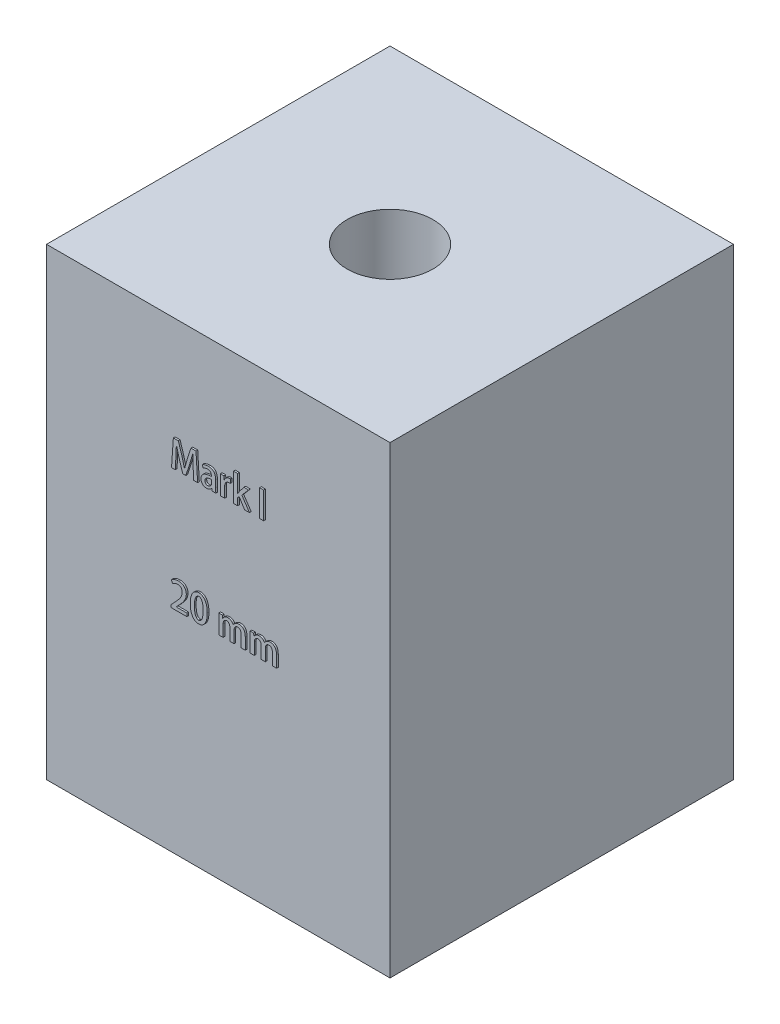
from build123d import *

# Parameters (mm, degrees)
CROQUIS1_W              = 20
CROQUIS1_H              = 20
CROQUIS1_R              = 2.5
SALIENTE_EXTRUIR1_DEPTH = 27
CROQUIS2_2_W            = 0.238171994
CROQUIS2_2_H            = 1.552222223
SALIENTE_EXTRUIR2_DEPTH = 0.1


with BuildPart() as part:
    # Croquis1 → Saliente-Extruir1 (new body)
    with BuildSketch(Plane(origin=(0, 0, 0), x_dir=(1, 0, 0), z_dir=(0, 1, 0))):
        Rectangle(CROQUIS1_W, CROQUIS1_H)
        Circle(CROQUIS1_R, mode=Mode.SUBTRACT)
    extrude(amount=SALIENTE_EXTRUIR1_DEPTH)

    # Croquis2<2> → Saliente-Extruir2 (add)
    # profile 1 of 9: a face of its own
    with BuildSketch(Plane.XY.offset(10)):
        with BuildLine():
            Line((-1.196299168, 21.029080524), (-1.489029741, 21.029080524))
            Line((-1.489029741, 21.029080524), (-1.713120041, 20.346907093))
            add(Edge.make_bspline(
                [(-1.713120041, 20.346907093), (-1.727697615, 20.299716085), (-1.756231951, 20.207343783), (-1.795341625, 20.070753521), (-1.829992127, 19.939079232), (-1.850660973, 19.852657221), (-1.860771731, 19.810381416)],
                knots=[0, 0, 0, 0, 1.06482216, 2.08429696, 3.06287894, 4, 4, 4, 4], degree=3))
            Line((-1.860771731, 19.810381416), (-1.866551238, 19.810381416))
            add(Edge.make_bspline(
                [(-1.866551238, 19.810381416), (-1.876481422, 19.853051166), (-1.896683618, 19.939859498), (-1.93070374, 20.071488595), (-1.967459767, 20.207101232), (-1.994351955, 20.298408277), (-2.008015817, 20.344801184)],
                knots=[0, 0, 0, 0, 0.950771496, 1.934271678, 2.950408035, 4, 4, 4, 4], degree=3))
            Line((-2.008015817, 20.344801184), (-2.225903251, 21.029080524))
            Line((-2.225903251, 21.029080524), (-2.516614993, 21.029080524))
            Line((-2.516614993, 21.029080524), (-2.621630897, 19.479409339))
            Line((-2.621630897, 19.479409339), (-2.403560427, 19.479409339))
            Line((-2.403560427, 19.479409339), (-2.36924029, 20.115225551))
            add(Edge.make_bspline(
                [(-2.36924029, 20.115225551), (-2.366142688, 20.170919846), (-2.35989255, 20.283296133), (-2.353809897, 20.423803434), (-2.348367501, 20.535729765), (-2.345730048, 20.61699773), (-2.342790327, 20.695298568), (-2.341738393, 20.746445045), (-2.341221555, 20.771574379)],
                knots=[0, 0, 0, 0, 1.528265809, 3.083634274, 3.853229214, 4.59840858, 5.311368824, 6, 6, 6, 6], degree=3))
            Line((-2.341221555, 20.771574379), (-2.334920154, 20.771597581))
            add(Edge.make_bspline(
                [(-2.334920154, 20.771597581), (-2.324589296, 20.723617077), (-2.303631025, 20.626278754), (-2.266531143, 20.479508668), (-2.225758304, 20.329473172), (-2.195122831, 20.22906041), (-2.179605039, 20.178198314)],
                knots=[0, 0, 0, 0, 0.959753872, 1.947058171, 2.960122984, 4, 4, 4, 4], degree=3))
            Line((-2.179605039, 20.178198314), (-1.967492815, 19.493601312))
            Line((-1.967492815, 19.493601312), (-1.791854471, 19.493601312))
            Line((-1.791854471, 19.493601312), (-1.561707676, 20.192452732))
            add(Edge.make_bspline(
                [(-1.561707676, 20.192452732), (-1.545557325, 20.241909213), (-1.513574545, 20.339848618), (-1.469197981, 20.486028271), (-1.427941936, 20.629553544), (-1.402746733, 20.724599981), (-1.390294614, 20.771574379)],
                knots=[0, 0, 0, 0, 1.033513873, 2.046682856, 3.034620343, 4, 4, 4, 4], degree=3))
            Line((-1.390294614, 20.771574379), (-1.384050501, 20.771597581))
            add(Edge.make_bspline(
                [(-1.384050501, 20.771597581), (-1.384147418, 20.746657815), (-1.384345026, 20.695806648), (-1.383338746, 20.618262138), (-1.381707988, 20.538078238), (-1.377545118, 20.428380993), (-1.371719332, 20.291107159), (-1.366485475, 20.18142271), (-1.363896272, 20.12716152)],
                knots=[0, 0, 0, 0, 0.69615936, 1.419440619, 2.164688967, 2.934803833, 4.483639269, 6, 6, 6, 6], degree=3))
            Line((-1.363896272, 20.12716152), (-1.32954205, 19.479409339))
            Line((-1.32954205, 19.479409339), (-1.103432918, 19.479409339))
            Line((-1.103432918, 19.479409339), (-1.196299168, 21.029080524))
        make_face()
    # profile 2 of 9: a face of its own
    with BuildSketch(Plane.XY.offset(10)):
        with BuildLine():
            add(Edge.make_bspline(
                [(-0.053952166, 20.155506797), (-0.053933683, 20.171094279), (-0.053897286, 20.201789221), (-0.057518774, 20.247008773), (-0.063893546, 20.290439821), (-0.073214651, 20.332080632), (-0.085936266, 20.371763587), (-0.101413142, 20.409687835), (-0.120056057, 20.445711117), (-0.141545368, 20.479861857), (-0.167086723, 20.511273005), (-0.197339407, 20.538867014), (-0.232386885, 20.562185402), (-0.272154981, 20.581216365), (-0.316470833, 20.596407), (-0.365308531, 20.607712644), (-0.418720262, 20.615108287), (-0.45586616, 20.61654487), (-0.475152092, 20.617290736)],
                knots=[0, 0, 0, 0, 1.04529413, 2.058397975, 3.039753549, 3.988049356, 4.917306062, 5.832005784, 6.732558164, 7.634995369, 8.534400609, 9.439717093, 10.371077683, 11.347885902, 12.389132223, 13.507522911, 14.705920534, 16, 16, 16, 16], degree=3))
            add(Edge.make_bspline(
                [(-0.475152092, 20.617290736), (-0.492957595, 20.616816764), (-0.528048962, 20.615882654), (-0.579600467, 20.61088989), (-0.629120436, 20.602765232), (-0.676037595, 20.591206125), (-0.720086934, 20.577835591), (-0.760725874, 20.56297161), (-0.797576215, 20.546416367), (-0.820085609, 20.533481991), (-0.830943079, 20.527243058)],
                knots=[0, 0, 0, 0, 1.151566781, 2.269526023, 3.346377101, 4.393757963, 5.391790339, 6.321988655, 7.190606464, 8, 8, 8, 8], degree=3))
            Line((-0.830943079, 20.527243058), (-0.781123083, 20.369063254))
            add(Edge.make_bspline(
                [(-0.781123083, 20.369063254), (-0.77171247, 20.37510656), (-0.75272953, 20.387297021), (-0.722239537, 20.403059962), (-0.690103274, 20.417263833), (-0.656139477, 20.428702506), (-0.621351216, 20.438541683), (-0.585956767, 20.445552861), (-0.550147937, 20.449783122), (-0.526200151, 20.450385225), (-0.514162975, 20.450687867)],
                knots=[0, 0, 0, 0, 0.947728913, 1.911743672, 2.906591377, 3.923705885, 4.947352295, 5.969890554, 6.979580645, 8, 8, 8, 8], degree=3))
            add(Edge.make_bspline(
                [(-0.514162975, 20.450687867), (-0.501813894, 20.449873349), (-0.478242904, 20.448318659), (-0.444972946, 20.442010936), (-0.415449317, 20.43362517), (-0.389446639, 20.42296027), (-0.367418177, 20.408938358), (-0.348994114, 20.39252782), (-0.334418974, 20.373321038), (-0.321472296, 20.344609444), (-0.310378364, 20.308152502), (-0.300596189, 20.265632707), (-0.296081909, 20.224913524), (-0.297364519, 20.198636491), (-0.297989886, 20.185824502)],
                knots=[0, 0, 0, 0, 1.124941475, 2.147203117, 3.073276344, 3.914150165, 4.693859246, 5.436944029, 6.148486199, 6.868538222, 8.288979618, 9.609682438, 10.834544209, 12, 12, 12, 12], degree=3))
            add(Edge.make_bspline(
                [(-0.297989886, 20.185824502), (-0.320678653, 20.185539999), (-0.365025123, 20.184983922), (-0.429782822, 20.180745531), (-0.490876774, 20.172779945), (-0.548357177, 20.161890924), (-0.60242818, 20.148446821), (-0.652727709, 20.130932907), (-0.699627981, 20.11078697), (-0.742785665, 20.087455124), (-0.78181461, 20.060849193), (-0.815831886, 20.03054531), (-0.844514985, 19.996643678), (-0.868702711, 19.959781778), (-0.887106432, 19.919009882), (-0.900985991, 19.875142448), (-0.90956491, 19.827714103), (-0.911105263, 19.794968866), (-0.911897994, 19.778116776)],
                knots=[0, 0, 0, 0, 1.312583045, 2.565517338, 3.751913568, 4.874585872, 5.948775456, 6.97196923, 7.952367169, 8.899011352, 9.80588498, 10.679130641, 11.525793372, 12.368308044, 13.221239438, 14.104974037, 15.024739096, 16, 16, 16, 16], degree=3))
            add(Edge.make_bspline(
                [(-0.911897994, 19.778116776), (-0.911473645, 19.767156476), (-0.910641021, 19.745651047), (-0.906633242, 19.713979761), (-0.899372869, 19.68374055), (-0.890222197, 19.654513549), (-0.877670348, 19.62680416), (-0.862708273, 19.600423672), (-0.845267409, 19.575176501), (-0.825103672, 19.551624148), (-0.802677089, 19.5297669), (-0.777493306, 19.511004679), (-0.750365313, 19.494799783), (-0.721140808, 19.481133874), (-0.689496917, 19.470690929), (-0.655746236, 19.462757034), (-0.61969828, 19.457773568), (-0.594937614, 19.456639732), (-0.582212035, 19.456057004)],
                knots=[0, 0, 0, 0, 1.019558823, 2.000497171, 2.961865832, 3.90763667, 4.843526869, 5.78386522, 6.724423229, 7.691661655, 8.662438953, 9.629634663, 10.603980382, 11.596308817, 12.622532153, 13.696327026, 14.81604254, 16, 16, 16, 16], degree=3))
            add(Edge.make_bspline(
                [(-0.582212035, 19.456057004), (-0.565841961, 19.456612545), (-0.533867175, 19.457697653), (-0.487707844, 19.466370755), (-0.444274735, 19.478668363), (-0.404395551, 19.496746116), (-0.368185088, 19.518848134), (-0.335215096, 19.543532898), (-0.306123182, 19.571455519), (-0.289918348, 19.592526447), (-0.281857566, 19.603007774)],
                knots=[0, 0, 0, 0, 1.130657597, 2.208452709, 3.237069398, 4.244418774, 5.223812689, 6.164576675, 7.087004055, 8, 8, 8, 8], degree=3))
            Line((-0.281857566, 19.603007774), (-0.275253111, 19.603065349))
            Line((-0.275253111, 19.603065349), (-0.258392086, 19.477618228))
            Line((-0.258392086, 19.477618228), (-0.037732768, 19.477618228))
            add(Edge.make_bspline(
                [(-0.037732768, 19.477618228), (-0.040897849, 19.496597162), (-0.047581659, 19.536675639), (-0.051747532, 19.600214154), (-0.05403103, 19.668395576), (-0.054172931, 19.715246615), (-0.054245195, 19.739105893)],
                knots=[0, 0, 0, 0, 0.879539962, 1.857355241, 2.908840502, 4, 4, 4, 4], degree=3))
            Line((-0.054245195, 19.739105893), (-0.053952166, 20.155506797))
        make_face()
        with BuildLine():
            add(Edge.make_bspline(
                [(-0.292123874, 19.85181673), (-0.292565708, 19.843563522), (-0.293425459, 19.827503836), (-0.297118337, 19.804055524), (-0.302157272, 19.781770952), (-0.30974875, 19.760760078), (-0.318698035, 19.74068664), (-0.329992125, 19.721921664), (-0.342912234, 19.704123049), (-0.357899957, 19.687847624), (-0.374138828, 19.672946445), (-0.391614279, 19.660011148), (-0.409781112, 19.64873434), (-0.42910308, 19.639619265), (-0.449388406, 19.632186668), (-0.470747733, 19.627011652), (-0.493045123, 19.623714024), (-0.508187646, 19.623016293), (-0.515922865, 19.622659873)],
                knots=[0, 0, 0, 0, 1.1127689, 2.165305488, 3.194083487, 4.185588777, 5.169981375, 6.15040018, 7.13046498, 8.12816315, 9.12586132, 10.095335325, 11.053196287, 12.001774197, 12.968470205, 13.958837393, 14.957317833, 16, 16, 16, 16], degree=3))
            add(Edge.make_bspline(
                [(-0.515922865, 19.622659873), (-0.526348867, 19.622986841), (-0.54677129, 19.623627305), (-0.576043385, 19.632361798), (-0.60296697, 19.646059855), (-0.627344866, 19.665200397), (-0.647756744, 19.69069521), (-0.66238159, 19.722675436), (-0.671428419, 19.760622731), (-0.672737046, 19.787936502), (-0.673432972, 19.802461914)],
                knots=[0, 0, 0, 0, 0.925162071, 1.812204857, 2.691873356, 3.602553412, 4.549923018, 5.56994314, 6.707700436, 8, 8, 8, 8], degree=3))
            add(Edge.make_bspline(
                [(-0.673432972, 19.802461914), (-0.672504166, 19.814124606), (-0.670710258, 19.836650073), (-0.664133484, 19.868903199), (-0.653394707, 19.897940713), (-0.639623735, 19.923993766), (-0.622452724, 19.947140376), (-0.60120143, 19.966485377), (-0.576944474, 19.983265842), (-0.53961783, 20.000360001), (-0.489300298, 20.016507544), (-0.426242327, 20.030369907), (-0.360162716, 20.037877182), (-0.315313119, 20.037760195), (-0.292416903, 20.037700472)],
                knots=[0, 0, 0, 0, 0.831751151, 1.606454387, 2.332498033, 3.02628555, 3.696675427, 4.370806108, 5.061344671, 5.786088267, 7.281491765, 8.811961156, 10.372470837, 12, 12, 12, 12], degree=3))
            Line((-0.292416903, 20.037700472), (-0.292123874, 19.85181673))
        make_face(mode=Mode.SUBTRACT)
    # profile 3 of 9: a face of its own
    with BuildSketch(Plane.XY.offset(10)):
        with BuildLine():
            add(Edge.make_bspline(
                [(0.798083824, 20.611553336), (0.788539911, 20.613210649), (0.769047446, 20.61659554), (0.749267113, 20.617055819), (0.739171639, 20.617290736)],
                knots=[0, 0, 0, 0, 0.97924127, 2, 2, 2, 2], degree=3))
            add(Edge.make_bspline(
                [(0.739171639, 20.617290736), (0.723847826, 20.616453707), (0.693455305, 20.614793584), (0.648964014, 20.602845287), (0.606665471, 20.583392189), (0.566554279, 20.557213359), (0.529366688, 20.524773207), (0.497456952, 20.485421616), (0.469512451, 20.440761818), (0.456024619, 20.407616391), (0.449083192, 20.39055831)],
                knots=[0, 0, 0, 0, 0.938175605, 1.860732817, 2.801619752, 3.780189859, 4.786007179, 5.811395864, 6.873648904, 8, 8, 8, 8], degree=3))
            Line((0.449083192, 20.39055831), (0.440870375, 20.390609296))
            Line((0.440870375, 20.390609296), (0.432657557, 20.593479237))
            Line((0.432657557, 20.593479237), (0.225386747, 20.593479237))
            add(Edge.make_bspline(
                [(0.225386747, 20.593479237), (0.226735788, 20.567494093), (0.229489608, 20.514450168), (0.231570538, 20.432608946), (0.233218682, 20.345688049), (0.233208637, 20.28584588), (0.233203418, 20.254753506)],
                knots=[0, 0, 0, 0, 0.921405029, 1.880880017, 2.898962507, 4, 4, 4, 4], degree=3))
            Line((0.233203418, 20.254753506), (0.233496446, 19.478268161))
            Line((0.233496446, 19.478268161), (0.47166844, 19.478268161))
            Line((0.47166844, 19.478268161), (0.47166844, 20.070276186))
            add(Edge.make_bspline(
                [(0.47166844, 20.070276186), (0.472033638, 20.082301823), (0.47274468, 20.105715785), (0.475848675, 20.139945871), (0.481442585, 20.172189381), (0.489050183, 20.202603479), (0.498765514, 20.231145838), (0.510353047, 20.258001793), (0.524589729, 20.282599339), (0.540410607, 20.305428882), (0.558265096, 20.325823855), (0.577615533, 20.344024212), (0.599106245, 20.358987052), (0.621896445, 20.371773551), (0.646567142, 20.381305855), (0.672514788, 20.388861822), (0.700215782, 20.393190292), (0.719212277, 20.393972346), (0.728905617, 20.394371404)],
                knots=[0, 0, 0, 0, 1.241840886, 2.417868999, 3.544527356, 4.616704577, 5.650820151, 6.654086497, 7.630544836, 8.5797601, 9.516878827, 10.423948895, 11.314471818, 12.213419717, 13.114913654, 14.038234368, 14.998969914, 16, 16, 16, 16], degree=3))
            add(Edge.make_bspline(
                [(0.728905617, 20.394371404), (0.741154195, 20.394190832), (0.764272582, 20.393850016), (0.787101102, 20.390214468), (0.797834621, 20.388505106)],
                knots=[0, 0, 0, 0, 1.059639438, 2, 2, 2, 2], degree=3))
            Line((0.797834621, 20.388505106), (0.798083824, 20.611553336))
        make_face()
    # profile 4 of 9: a face of its own
    with BuildSketch(Plane.XY.offset(10)):
        with BuildLine():
            Line((1.473955281, 20.134031505), (1.867275682, 20.594647054))
            Line((1.867275682, 20.594647054), (1.589518491, 20.594647054))
            Line((1.589518491, 20.594647054), (1.311761301, 20.221284671))
            add(Edge.make_bspline(
                [(1.311761301, 20.221284671), (1.297091766, 20.200201073), (1.267485244, 20.157649487), (1.240155846, 20.113600536), (1.226367706, 20.091377101)],
                knots=[0, 0, 0, 0, 0.99096644, 2, 2, 2, 2], degree=3))
            Line((1.226367706, 20.091377101), (1.222554612, 20.091419494))
            Line((1.222554612, 20.091419494), (1.222554612, 21.103899887))
            Line((1.222554612, 21.103899887), (0.984382618, 21.103899887))
            Line((0.984382618, 21.103899887), (0.984382618, 19.476589047))
            Line((0.984382618, 19.476589047), (1.222554612, 19.476589047))
            Line((1.222554612, 19.476589047), (1.222554612, 19.878359438))
            Line((1.222554612, 19.878359438), (1.313788726, 19.989962325))
            Line((1.313788726, 19.989962325), (1.634121836, 19.476589047))
            Line((1.634121836, 19.476589047), (1.9179613, 19.476589047))
            Line((1.9179613, 19.476589047), (1.473955281, 20.134031505))
        make_face()
    # profile 5 of 9: a face of its own
    with BuildSketch(Plane.XY.offset(10)):
        with Locations((2.624013114, 20.252700159)):
            Rectangle(CROQUIS2_2_W, CROQUIS2_2_H)
    # profile 6 of 9: a face of its own
    with BuildSketch(Plane.XY.offset(10)):
        with BuildLine():
            Line((-1.729779412, 12.591282835), (-2.347079547, 12.591282835))
            Line((-2.347079547, 12.591282835), (-2.347079547, 12.595407576))
            Line((-2.347079547, 12.595407576), (-2.221379213, 12.725336915))
            add(Edge.make_bspline(
                [(-2.221379213, 12.725336915), (-2.204836392, 12.741929731), (-2.172130158, 12.774734809), (-2.125007035, 12.824611936), (-2.080052764, 12.874052065), (-2.037820827, 12.923529334), (-1.997692725, 12.972318339), (-1.95987069, 13.0207424), (-1.925257654, 13.069323079), (-1.891976613, 13.1169088), (-1.862320849, 13.164984102), (-1.83624939, 13.213577533), (-1.814289817, 13.262916553), (-1.795899775, 13.312829022), (-1.781923907, 13.363609606), (-1.771217384, 13.414809568), (-1.764711161, 13.466817015), (-1.763247157, 13.501666325), (-1.762511236, 13.519184269)],
                knots=[0, 0, 0, 0, 1.195381854, 2.363347745, 3.50053777, 4.604304725, 5.681810837, 6.723515834, 7.73832273, 8.724868519, 9.685653219, 10.618474166, 11.536235179, 12.438891752, 13.329671478, 14.220912006, 15.105693524, 16, 16, 16, 16], degree=3))
            add(Edge.make_bspline(
                [(-1.762511236, 13.519184269), (-1.762728216, 13.534062394), (-1.763154906, 13.563320123), (-1.768456925, 13.606351952), (-1.776349996, 13.647885302), (-1.788646422, 13.687536477), (-1.803749682, 13.72571118), (-1.82304204, 13.761798915), (-1.84550254, 13.796344594), (-1.871070205, 13.82925096), (-1.900713002, 13.859312823), (-1.93446452, 13.885568813), (-1.972084801, 13.908033867), (-2.013688649, 13.926468614), (-2.059168106, 13.941000269), (-2.108390202, 13.952239224), (-2.161625054, 13.959188152), (-2.198454799, 13.960715644), (-2.217442663, 13.961503155)],
                knots=[0, 0, 0, 0, 0.995320378, 1.957290544, 2.898101081, 3.821472585, 4.731739661, 5.642218458, 6.555304432, 7.487493673, 8.426937414, 9.373466941, 10.342092883, 11.352807763, 12.412470548, 13.533359811, 14.728304285, 16, 16, 16, 16], degree=3))
            add(Edge.make_bspline(
                [(-2.217442663, 13.961503155), (-2.238486604, 13.960756275), (-2.279633046, 13.959295928), (-2.340004119, 13.95157392), (-2.39747755, 13.939144304), (-2.4516104, 13.921565146), (-2.502273951, 13.901309448), (-2.548636156, 13.877879848), (-2.591273298, 13.85313624), (-2.616630934, 13.833689563), (-2.628963483, 13.824231777)],
                knots=[0, 0, 0, 0, 1.143909725, 2.236644427, 3.302870934, 4.334659843, 5.326304614, 6.264941716, 7.156163776, 8, 8, 8, 8], degree=3))
            Line((-2.628963483, 13.824231777), (-2.55793172, 13.655465996))
            add(Edge.make_bspline(
                [(-2.55793172, 13.655465996), (-2.548666952, 13.662974348), (-2.529664826, 13.678374046), (-2.498481479, 13.699311693), (-2.464588883, 13.719182069), (-2.428587657, 13.738355937), (-2.390230799, 13.754901619), (-2.34968305, 13.766921568), (-2.307488605, 13.774782404), (-2.278681659, 13.776259402), (-2.264079734, 13.777008076)],
                knots=[0, 0, 0, 0, 0.882843515, 1.810720216, 2.778130362, 3.791908233, 4.830190049, 5.865690636, 6.91814204, 8, 8, 8, 8], degree=3))
            add(Edge.make_bspline(
                [(-2.264079734, 13.777008076), (-2.252620384, 13.776545229), (-2.230390088, 13.775647339), (-2.198456504, 13.77071411), (-2.168885073, 13.764251543), (-2.141889106, 13.754806975), (-2.117568342, 13.742722433), (-2.095463328, 13.728659582), (-2.076249435, 13.711779085), (-2.059862268, 13.692456134), (-2.04551936, 13.671654647), (-2.033225093, 13.64948128), (-2.022541238, 13.626435013), (-2.014400364, 13.602077197), (-2.007961304, 13.576782672), (-2.003119809, 13.550346034), (-2.000927724, 13.522743278), (-2.000765296, 13.504032346), (-2.000682944, 13.494545817)],
                knots=[0, 0, 0, 0, 1.252980104, 2.430689377, 3.52761197, 4.558806516, 5.548436465, 6.491350754, 7.41553586, 8.332707944, 9.254912475, 10.173827287, 11.1018993, 12.028184129, 12.97713893, 13.954334826, 14.962838355, 16, 16, 16, 16], degree=3))
            add(Edge.make_bspline(
                [(-2.000682944, 13.494545817), (-2.001196735, 13.480248347), (-2.002232305, 13.451431111), (-2.008771935, 13.40809214), (-2.018475523, 13.364301994), (-2.033357189, 13.320361455), (-2.051364274, 13.275883645), (-2.073635323, 13.231052752), (-2.099748375, 13.18586293), (-2.130283105, 13.140281529), (-2.164753083, 13.093691499), (-2.201749306, 13.044535207), (-2.243063005, 12.993943275), (-2.287597736, 12.941004051), (-2.336105136, 12.886407734), (-2.387605137, 12.829298059), (-2.443269188, 12.770728317), (-2.481684749, 12.73111099), (-2.501371497, 12.710808375)],
                knots=[0, 0, 0, 0, 0.72150536, 1.454228671, 2.20835524, 2.982319522, 3.792345563, 4.628710786, 5.506385041, 6.424690228, 7.395867932, 8.431131342, 9.529291015, 10.691804108, 11.922384402, 13.214899875, 14.57272513, 16, 16, 16, 16], degree=3))
            Line((-2.501371497, 12.710808375), (-2.661330382, 12.543229889))
            Line((-2.661330382, 12.543229889), (-2.661330382, 12.406787183))
            Line((-2.661330382, 12.406787183), (-1.729779412, 12.406787183))
            Line((-1.729779412, 12.406787183), (-1.729779412, 12.591282835))
        make_face()
    # profile 7 of 9: a face of its own
    with BuildSketch(Plane.XY.offset(10)):
        with BuildLine():
            add(Edge.make_bspline(
                [(-1.042610748, 12.388015029), (-1.023441122, 12.388668567), (-0.98588999, 12.389948775), (-0.931195762, 12.399835728), (-0.879832101, 12.415978098), (-0.831710785, 12.438457433), (-0.787149685, 12.467554445), (-0.745721165, 12.502799553), (-0.707814724, 12.5444702), (-0.673440827, 12.592376919), (-0.642631058, 12.646208836), (-0.616009253, 12.706103224), (-0.593480897, 12.771790365), (-0.575218335, 12.843342421), (-0.560533813, 12.920721581), (-0.550241449, 13.003998439), (-0.54368267, 13.093088936), (-0.542784248, 13.154386241), (-0.542321207, 13.18597853)],
                knots=[0, 0, 0, 0, 0.870696281, 1.705595656, 2.516350062, 3.311357778, 4.111130694, 4.927465531, 5.776524699, 6.664348225, 7.60171378, 8.590083443, 9.638235951, 10.753539253, 11.94293492, 13.214798286, 14.564522568, 16, 16, 16, 16], degree=3))
            add(Edge.make_bspline(
                [(-0.542321207, 13.18597853), (-0.542584319, 13.214734989), (-0.543096817, 13.270747529), (-0.549224638, 13.352378809), (-0.558456615, 13.429549109), (-0.571347645, 13.502240199), (-0.588912941, 13.570340702), (-0.609456747, 13.634097802), (-0.634118318, 13.693294542), (-0.662482618, 13.747689511), (-0.694461981, 13.796910593), (-0.730845348, 13.839750764), (-0.77061279, 13.876637806), (-0.814472061, 13.906850978), (-0.862176087, 13.930571221), (-0.913765931, 13.94746045), (-0.968924349, 13.958640941), (-1.007072872, 13.960534622), (-1.026584125, 13.961503155)],
                knots=[0, 0, 0, 0, 1.348598241, 2.626833012, 3.837323855, 4.993252023, 6.086653137, 7.133754439, 8.132822275, 9.090804279, 10.007900934, 10.879914043, 11.720575117, 12.54490278, 13.369396272, 14.210545074, 15.084774353, 16, 16, 16, 16], degree=3))
            add(Edge.make_bspline(
                [(-1.026584125, 13.961503155), (-1.045987332, 13.96069907), (-1.083880009, 13.959128768), (-1.138990672, 13.948938037), (-1.190724204, 13.9325674), (-1.239070521, 13.909414026), (-1.283926186, 13.879755999), (-1.325636708, 13.843916915), (-1.363842335, 13.801671798), (-1.398421154, 13.753228797), (-1.429551012, 13.699139804), (-1.456413506, 13.639333002), (-1.47929517, 13.574170719), (-1.497937263, 13.50362709), (-1.512389609, 13.427738432), (-1.523320041, 13.34658507), (-1.52960997, 13.25989336), (-1.530777696, 13.200263055), (-1.531379086, 13.169552895)],
                knots=[0, 0, 0, 0, 0.885786215, 1.729858878, 2.550092024, 3.356753299, 4.168966232, 4.998392219, 5.861110803, 6.763026954, 7.71096382, 8.705887709, 9.752087664, 10.860900304, 12.034055661, 13.277157086, 14.597710659, 16, 16, 16, 16], degree=3))
            add(Edge.make_bspline(
                [(-1.531379086, 13.169552895), (-1.531024787, 13.140501089), (-1.530334433, 13.083893558), (-1.523823588, 13.001301514), (-1.514580324, 12.923279856), (-1.500677711, 12.849926102), (-1.483217094, 12.781192564), (-1.461876762, 12.716876964), (-1.436366053, 12.657370431), (-1.407435614, 12.602518435), (-1.374788202, 12.55315179), (-1.33826174, 12.509807714), (-1.297811719, 12.47309317), (-1.253640109, 12.442931612), (-1.2061139, 12.418783845), (-1.154739847, 12.401972103), (-1.09999629, 12.390696937), (-1.062132522, 12.388827356), (-1.042610748, 12.388015029)],
                knots=[0, 0, 0, 0, 1.353423849, 2.637150346, 3.858261108, 5.012665895, 6.113189956, 7.160539399, 8.16670341, 9.126620219, 10.046469106, 10.919123896, 11.760946034, 12.583565319, 13.404631502, 14.235884548, 15.095383165, 16, 16, 16, 16], degree=3))
        make_face()
        with BuildLine():
            add(Edge.make_bspline(
                [(-1.038573658, 12.572510681), (-1.048520509, 12.573047376), (-1.068139332, 12.574105934), (-1.096395981, 12.582519637), (-1.122978599, 12.595205927), (-1.147481539, 12.613225166), (-1.170301727, 12.63584659), (-1.191135695, 12.663490546), (-1.210091031, 12.695964331), (-1.227265481, 12.7330526), (-1.242721118, 12.774433898), (-1.256232578, 12.819987548), (-1.267108258, 12.869749213), (-1.276551525, 12.923455483), (-1.283773791, 12.981313842), (-1.28895721, 13.043155672), (-1.292234462, 13.109095014), (-1.292682768, 13.154394313), (-1.292914064, 13.177765713)],
                knots=[0, 0, 0, 0, 0.666398031, 1.31438028, 1.962893771, 2.634846584, 3.344681637, 4.112349672, 4.950647476, 5.86347927, 6.851779693, 7.912578033, 9.049075701, 10.267961701, 11.570849897, 12.960254545, 14.431695278, 16, 16, 16, 16], degree=3))
            add(Edge.make_bspline(
                [(-1.292914064, 13.177765713), (-1.292622709, 13.201140128), (-1.292056668, 13.246551624), (-1.287981905, 13.312465532), (-1.282740373, 13.374255788), (-1.274711836, 13.431780399), (-1.265042841, 13.4852283), (-1.252529034, 13.534301133), (-1.238743865, 13.579446585), (-1.222273133, 13.620178048), (-1.204303884, 13.656579804), (-1.184611463, 13.688271914), (-1.16346553, 13.715241355), (-1.140869395, 13.737593209), (-1.116482995, 13.754937469), (-1.090622914, 13.767415547), (-1.063236138, 13.775492128), (-1.044335859, 13.776499605), (-1.034796942, 13.777008076)],
                knots=[0, 0, 0, 0, 1.581052361, 3.071646956, 4.466225399, 5.774778899, 6.999321057, 8.13822646, 9.198772947, 10.189899711, 11.106816715, 11.941785511, 12.709246862, 13.420164871, 14.084452052, 14.723397775, 15.355702508, 16, 16, 16, 16], degree=3))
            add(Edge.make_bspline(
                [(-1.034796942, 13.777008076), (-1.024082287, 13.776313321), (-1.003022702, 13.774947785), (-0.972800728, 13.76638471), (-0.944707798, 13.753432307), (-0.919139232, 13.735056947), (-0.895875205, 13.711930723), (-0.874952704, 13.683869193), (-0.856144601, 13.651087368), (-0.840064855, 13.613438621), (-0.82572754, 13.57175489), (-0.813621983, 13.526216041), (-0.802984744, 13.477106406), (-0.794595266, 13.42431815), (-0.788268821, 13.367833695), (-0.783551842, 13.307772841), (-0.780983975, 13.243979965), (-0.780659703, 13.20025537), (-0.780492914, 13.177765713)],
                knots=[0, 0, 0, 0, 0.720966059, 1.417054204, 2.100078545, 2.793954457, 3.524557493, 4.299796832, 5.143005199, 6.062454772, 7.05102079, 8.107851098, 9.232113941, 10.431958672, 11.703767055, 13.056962832, 14.486254779, 16, 16, 16, 16], degree=3))
            add(Edge.make_bspline(
                [(-0.780492914, 13.177765713), (-0.780469731, 13.157623598), (-0.780424139, 13.118012006), (-0.782427144, 13.059597367), (-0.786575172, 13.003450871), (-0.792318735, 12.949510785), (-0.800312724, 12.897865092), (-0.809918226, 12.848335321), (-0.821287445, 12.801007253), (-0.834591758, 12.756349983), (-0.849863906, 12.715214572), (-0.868505802, 12.679000781), (-0.889548341, 12.647756022), (-0.913810531, 12.621747233), (-0.941170121, 12.601388606), (-0.970905635, 12.585635814), (-1.003833642, 12.575863343), (-1.026815962, 12.573550594), (-1.038573658, 12.572510681)],
                knots=[0, 0, 0, 0, 1.341939408, 2.639065411, 3.893110861, 5.09230624, 6.252216656, 7.373906837, 8.453023627, 9.493766498, 10.477323239, 11.371762395, 12.201113983, 12.97990739, 13.729039495, 14.463267275, 15.211379073, 16, 16, 16, 16], degree=3))
        make_face(mode=Mode.SUBTRACT)
    # profile 8 of 9: a face of its own
    with BuildSketch(Plane.XY.offset(10)):
        with BuildLine():
            add(Edge.make_bspline(
                [(1.673086029, 13.090464425), (1.67215772, 13.111077003), (1.670365963, 13.150861952), (1.663815589, 13.208116919), (1.654840245, 13.260791645), (1.641836074, 13.308435454), (1.626213175, 13.351330131), (1.607054541, 13.389270084), (1.584725268, 13.42252538), (1.55905493, 13.450782133), (1.531172757, 13.474285603), (1.502990684, 13.495127157), (1.473861975, 13.512414251), (1.444116532, 13.526724485), (1.413415931, 13.53741003), (1.381877872, 13.544208935), (1.34978937, 13.548726162), (1.328163308, 13.548586131), (1.317295329, 13.54851576)],
                knots=[0, 0, 0, 0, 1.513261231, 2.920790482, 4.225039661, 5.429095985, 6.538902965, 7.568588871, 8.539409605, 9.468669045, 10.358677973, 11.210859535, 12.037483604, 12.839564471, 13.628941055, 14.4154775, 15.203712731, 16, 16, 16, 16], degree=3))
            add(Edge.make_bspline(
                [(1.317295329, 13.54851576), (1.298079599, 13.547757116), (1.260829637, 13.546286475), (1.207305651, 13.535705198), (1.157840201, 13.519457225), (1.112968522, 13.495943442), (1.072406348, 13.466676206), (1.034744112, 13.433531571), (1.00106113, 13.395010462), (0.981834694, 13.366489389), (0.972063678, 13.35199477)],
                knots=[0, 0, 0, 0, 1.108126197, 2.148118191, 3.136426768, 4.10280475, 5.057637098, 6.016626622, 6.992035069, 8, 8, 8, 8], degree=3))
            Line((0.972063678, 13.35199477), (0.968006824, 13.352002217))
            add(Edge.make_bspline(
                [(0.968006824, 13.352002217), (0.961392471, 13.366707133), (0.948448558, 13.39548382), (0.921685547, 13.434177719), (0.890103124, 13.46783246), (0.853781486, 13.49650351), (0.813254282, 13.519473905), (0.768881432, 13.535897487), (0.721292811, 13.546591562), (0.688291365, 13.547864722), (0.671415895, 13.54851576)],
                knots=[0, 0, 0, 0, 1.020955632, 1.99795227, 2.96752067, 3.938931661, 4.92195175, 5.909051468, 6.930781959, 8, 8, 8, 8], degree=3))
            add(Edge.make_bspline(
                [(0.671415895, 13.54851576), (0.6521002, 13.547449292), (0.61511286, 13.545407129), (0.562388939, 13.534511912), (0.515249124, 13.517070985), (0.474221835, 13.492789433), (0.438592589, 13.464778075), (0.407276231, 13.434690478), (0.380074943, 13.402786337), (0.365787507, 13.379377136), (0.3587422, 13.367833775)],
                knots=[0, 0, 0, 0, 1.224631561, 2.345029053, 3.39800305, 4.394808606, 5.352867572, 6.264332918, 7.144121535, 8, 8, 8, 8], degree=3))
            Line((0.3587422, 13.367833775), (0.352736119, 13.368050897))
            Line((0.352736119, 13.368050897), (0.340200343, 13.525358204))
            Line((0.340200343, 13.525358204), (0.131525976, 13.525358204))
            add(Edge.make_bspline(
                [(0.131525976, 13.525358204), (0.132493307, 13.502377927), (0.134468753, 13.455448483), (0.136595679, 13.39589831), (0.138368214, 13.345843903), (0.138685915, 13.305454338), (0.139522755, 13.262536495), (0.139403866, 13.233104947), (0.139342646, 13.217949856)],
                knots=[0, 0, 0, 0, 1.346187736, 2.749133221, 3.487683855, 4.277464658, 5.113020504, 6, 6, 6, 6], degree=3))
            Line((0.139342646, 13.217949856), (0.139635675, 12.415331985))
            Line((0.139635675, 12.415331985), (0.377807669, 12.415331985))
            Line((0.377807669, 12.415331985), (0.377807669, 13.09249185))
            add(Edge.make_bspline(
                [(0.377807669, 13.09249185), (0.378348178, 13.103232166), (0.379399057, 13.124113934), (0.383309839, 13.154351077), (0.388603781, 13.182714145), (0.396741567, 13.208921168), (0.4063118, 13.233312822), (0.417749669, 13.255813951), (0.431292194, 13.276229203), (0.446897459, 13.294305112), (0.463581554, 13.3102841), (0.480601331, 13.324459513), (0.498012247, 13.336630126), (0.515924601, 13.346708092), (0.534444651, 13.354404904), (0.553412463, 13.359518265), (0.572608886, 13.363404703), (0.585650228, 13.363814309), (0.592220869, 13.364020681)],
                knots=[0, 0, 0, 0, 1.345028047, 2.615059288, 3.812240957, 4.950008049, 6.042686379, 7.08768926, 8.102172383, 9.099996684, 10.068982838, 10.989984122, 11.868914175, 12.723236376, 13.556990843, 14.370301474, 15.178906315, 16, 16, 16, 16], degree=3))
            add(Edge.make_bspline(
                [(0.592220869, 13.364020681), (0.600061394, 13.363617765), (0.615262384, 13.362836603), (0.637138995, 13.358672907), (0.657348023, 13.35218983), (0.676014706, 13.343336594), (0.693028444, 13.332125134), (0.70865157, 13.318820156), (0.722008049, 13.302722765), (0.73839249, 13.2784282), (0.754230828, 13.243127456), (0.768611103, 13.196390913), (0.776167652, 13.143983411), (0.777106302, 13.107390927), (0.777595893, 13.088304665)],
                knots=[0, 0, 0, 0, 0.755950668, 1.465615932, 2.139074498, 2.796588983, 3.449971736, 4.097964407, 4.76639413, 5.458962618, 6.917416126, 8.473425038, 10.160574856, 12, 12, 12, 12], degree=3))
            Line((0.777595893, 13.088304665), (0.777888921, 12.415331985))
            Line((0.777888921, 12.415331985), (1.016060629, 12.415331985))
            Line((1.016060629, 12.415331985), (1.016060629, 13.104656398))
            add(Edge.make_bspline(
                [(1.016060629, 13.104656398), (1.016353399, 13.114571964), (1.016923084, 13.133866112), (1.021025984, 13.161890797), (1.026417888, 13.188429555), (1.034052204, 13.213245523), (1.043384886, 13.236423752), (1.055028985, 13.257615396), (1.06812976, 13.277456637), (1.08339485, 13.295181398), (1.099920174, 13.311035697), (1.117023788, 13.325066276), (1.13481524, 13.336940192), (1.153152668, 13.346742493), (1.172119183, 13.354409104), (1.191853198, 13.359596926), (1.211950274, 13.363375547), (1.225665744, 13.363805556), (1.232527319, 13.364020681)],
                knots=[0, 0, 0, 0, 1.267233675, 2.465839704, 3.615673463, 4.726804397, 5.780700789, 6.804285049, 7.813184962, 8.815168933, 9.787633234, 10.738404153, 11.639821434, 12.517791614, 13.392909498, 14.248069017, 15.123543946, 16, 16, 16, 16], degree=3))
            add(Edge.make_bspline(
                [(1.232527319, 13.364020681), (1.24104506, 13.363598871), (1.257591622, 13.362779462), (1.281637079, 13.358845879), (1.303617687, 13.351507281), (1.324280038, 13.342725949), (1.342511559, 13.330226053), (1.359492705, 13.315984048), (1.374201521, 13.298535998), (1.387325849, 13.278934345), (1.398746755, 13.257167011), (1.408343734, 13.233402408), (1.416920116, 13.207997405), (1.423645135, 13.180618265), (1.428409127, 13.151460102), (1.4324143, 13.120568649), (1.434335708, 13.087743085), (1.434524513, 13.065232341), (1.434621293, 13.053693505)],
                knots=[0, 0, 0, 0, 0.979325905, 1.902438322, 2.786756391, 3.636233264, 4.470958944, 5.315074409, 6.175027208, 7.081388835, 8.020752095, 8.99258041, 10.022434341, 11.098284182, 12.226320848, 13.414468146, 14.674676153, 16, 16, 16, 16], degree=3))
            Line((1.434621293, 13.053693505), (1.434914035, 12.415331985))
            Line((1.434914035, 12.415331985), (1.673086029, 12.415331985))
            Line((1.673086029, 12.415331985), (1.673086029, 13.090464425))
        make_face()
    # profile 9 of 9: a face of its own
    with BuildSketch(Plane.XY.offset(10)):
        with BuildLine():
            add(Edge.make_bspline(
                [(3.493984996, 13.090464425), (3.493056687, 13.111077003), (3.49126493, 13.150861952), (3.484714556, 13.208116919), (3.475739212, 13.260791645), (3.462735041, 13.308435454), (3.447112142, 13.351330131), (3.427953508, 13.389270084), (3.405624235, 13.42252538), (3.379953897, 13.450782133), (3.352071724, 13.474285603), (3.323889651, 13.495127157), (3.294760942, 13.512414251), (3.2650155, 13.526724485), (3.234314898, 13.53741003), (3.202776839, 13.544208935), (3.170688337, 13.548726162), (3.149062275, 13.548586131), (3.138194296, 13.54851576)],
                knots=[0, 0, 0, 0, 1.513261231, 2.920790482, 4.225039661, 5.429095985, 6.538902965, 7.568588871, 8.539409605, 9.468669045, 10.358677973, 11.210859535, 12.037483604, 12.839564471, 13.628941055, 14.4154775, 15.203712731, 16, 16, 16, 16], degree=3))
            add(Edge.make_bspline(
                [(3.138194296, 13.54851576), (3.118978566, 13.547757116), (3.081728604, 13.546286475), (3.028204618, 13.535705198), (2.978739168, 13.519457225), (2.933867489, 13.495943442), (2.893305315, 13.466676206), (2.855643079, 13.433531571), (2.821960097, 13.395010462), (2.802733661, 13.366489389), (2.792962646, 13.35199477)],
                knots=[0, 0, 0, 0, 1.108126197, 2.148118191, 3.136426768, 4.10280475, 5.057637098, 6.016626622, 6.992035069, 8, 8, 8, 8], degree=3))
            Line((2.792962646, 13.35199477), (2.788905791, 13.352002217))
            add(Edge.make_bspline(
                [(2.788905791, 13.352002217), (2.782291438, 13.366707133), (2.769347526, 13.39548382), (2.742584514, 13.434177719), (2.711002091, 13.46783246), (2.674680453, 13.49650351), (2.634153249, 13.519473905), (2.589780399, 13.535897487), (2.542191778, 13.546591562), (2.509190332, 13.547864722), (2.492314862, 13.54851576)],
                knots=[0, 0, 0, 0, 1.020955632, 1.99795227, 2.96752067, 3.938931661, 4.92195175, 5.909051468, 6.930781959, 8, 8, 8, 8], degree=3))
            add(Edge.make_bspline(
                [(2.492314862, 13.54851576), (2.472999167, 13.547449292), (2.436011827, 13.545407129), (2.383287906, 13.534511912), (2.336148092, 13.517070985), (2.295120802, 13.492789433), (2.259491556, 13.464778075), (2.228175198, 13.434690478), (2.20097391, 13.402786337), (2.186686475, 13.379377136), (2.179641167, 13.367833775)],
                knots=[0, 0, 0, 0, 1.224631561, 2.345029053, 3.39800305, 4.394808606, 5.352867572, 6.264332918, 7.144121535, 8, 8, 8, 8], degree=3))
            Line((2.179641167, 13.367833775), (2.173635086, 13.368050897))
            Line((2.173635086, 13.368050897), (2.161099311, 13.525358204))
            Line((2.161099311, 13.525358204), (1.952424943, 13.525358204))
            add(Edge.make_bspline(
                [(1.952424943, 13.525358204), (1.953392274, 13.502377927), (1.95536772, 13.455448483), (1.957494646, 13.39589831), (1.959267181, 13.345843903), (1.959584882, 13.305454338), (1.960421722, 13.262536495), (1.960302833, 13.233104947), (1.960241613, 13.217949856)],
                knots=[0, 0, 0, 0, 1.346187736, 2.749133221, 3.487683855, 4.277464658, 5.113020504, 6, 6, 6, 6], degree=3))
            Line((1.960241613, 13.217949856), (1.960534642, 12.415331985))
            Line((1.960534642, 12.415331985), (2.198706636, 12.415331985))
            Line((2.198706636, 12.415331985), (2.198706636, 13.09249185))
            add(Edge.make_bspline(
                [(2.198706636, 13.09249185), (2.199247145, 13.103232166), (2.200298025, 13.124113934), (2.204208806, 13.154351077), (2.209502748, 13.182714145), (2.217640534, 13.208921168), (2.227210767, 13.233312822), (2.238648636, 13.255813951), (2.252191161, 13.276229203), (2.267796426, 13.294305112), (2.284480521, 13.3102841), (2.301500299, 13.324459513), (2.318911214, 13.336630126), (2.336823568, 13.346708092), (2.355343618, 13.354404904), (2.37431143, 13.359518265), (2.393507853, 13.363404703), (2.406549195, 13.363814309), (2.413119836, 13.364020681)],
                knots=[0, 0, 0, 0, 1.345028047, 2.615059288, 3.812240957, 4.950008049, 6.042686379, 7.08768926, 8.102172383, 9.099996684, 10.068982838, 10.989984122, 11.868914175, 12.723236376, 13.556990843, 14.370301474, 15.178906315, 16, 16, 16, 16], degree=3))
            add(Edge.make_bspline(
                [(2.413119836, 13.364020681), (2.420960361, 13.363617765), (2.436161351, 13.362836603), (2.458037962, 13.358672907), (2.47824699, 13.35218983), (2.496913673, 13.343336594), (2.513927411, 13.332125134), (2.529550537, 13.318820156), (2.542907016, 13.302722765), (2.559291457, 13.2784282), (2.575129795, 13.243127456), (2.58951007, 13.196390913), (2.597066619, 13.143983411), (2.598005269, 13.107390927), (2.59849486, 13.088304665)],
                knots=[0, 0, 0, 0, 0.755950668, 1.465615932, 2.139074498, 2.796588983, 3.449971736, 4.097964407, 4.76639413, 5.458962618, 6.917416126, 8.473425038, 10.160574856, 12, 12, 12, 12], degree=3))
            Line((2.59849486, 13.088304665), (2.598787888, 12.415331985))
            Line((2.598787888, 12.415331985), (2.836959596, 12.415331985))
            Line((2.836959596, 12.415331985), (2.836959596, 13.104656398))
            add(Edge.make_bspline(
                [(2.836959596, 13.104656398), (2.837252366, 13.114571964), (2.837822051, 13.133866112), (2.841924951, 13.161890797), (2.847316855, 13.188429555), (2.854951171, 13.213245523), (2.864283853, 13.236423752), (2.875927952, 13.257615396), (2.889028727, 13.277456637), (2.904293817, 13.295181398), (2.920819141, 13.311035697), (2.937922755, 13.325066276), (2.955714207, 13.336940192), (2.974051635, 13.346742493), (2.99301815, 13.354409104), (3.012752165, 13.359596926), (3.032849241, 13.363375547), (3.046564711, 13.363805556), (3.053426286, 13.364020681)],
                knots=[0, 0, 0, 0, 1.267233675, 2.465839704, 3.615673463, 4.726804397, 5.780700789, 6.804285049, 7.813184962, 8.815168933, 9.787633234, 10.738404153, 11.639821434, 12.517791614, 13.392909498, 14.248069017, 15.123543946, 16, 16, 16, 16], degree=3))
            add(Edge.make_bspline(
                [(3.053426286, 13.364020681), (3.061944027, 13.363598871), (3.078490589, 13.362779462), (3.102536046, 13.358845879), (3.124516654, 13.351507281), (3.145179005, 13.342725949), (3.163410526, 13.330226053), (3.180391672, 13.315984048), (3.195100488, 13.298535998), (3.208224816, 13.278934345), (3.219645722, 13.257167011), (3.229242701, 13.233402408), (3.237819083, 13.207997405), (3.244544102, 13.180618265), (3.249308094, 13.151460102), (3.253313267, 13.120568649), (3.255234675, 13.087743085), (3.25542348, 13.065232341), (3.25552026, 13.053693505)],
                knots=[0, 0, 0, 0, 0.979325905, 1.902438322, 2.786756391, 3.636233264, 4.470958944, 5.315074409, 6.175027208, 7.081388835, 8.020752095, 8.99258041, 10.022434341, 11.098284182, 12.226320848, 13.414468146, 14.674676153, 16, 16, 16, 16], degree=3))
            Line((3.25552026, 13.053693505), (3.255813002, 12.415331985))
            Line((3.255813002, 12.415331985), (3.493984996, 12.415331985))
            Line((3.493984996, 12.415331985), (3.493984996, 13.090464425))
        make_face()
    extrude(amount=SALIENTE_EXTRUIR2_DEPTH)


solid = part.part
